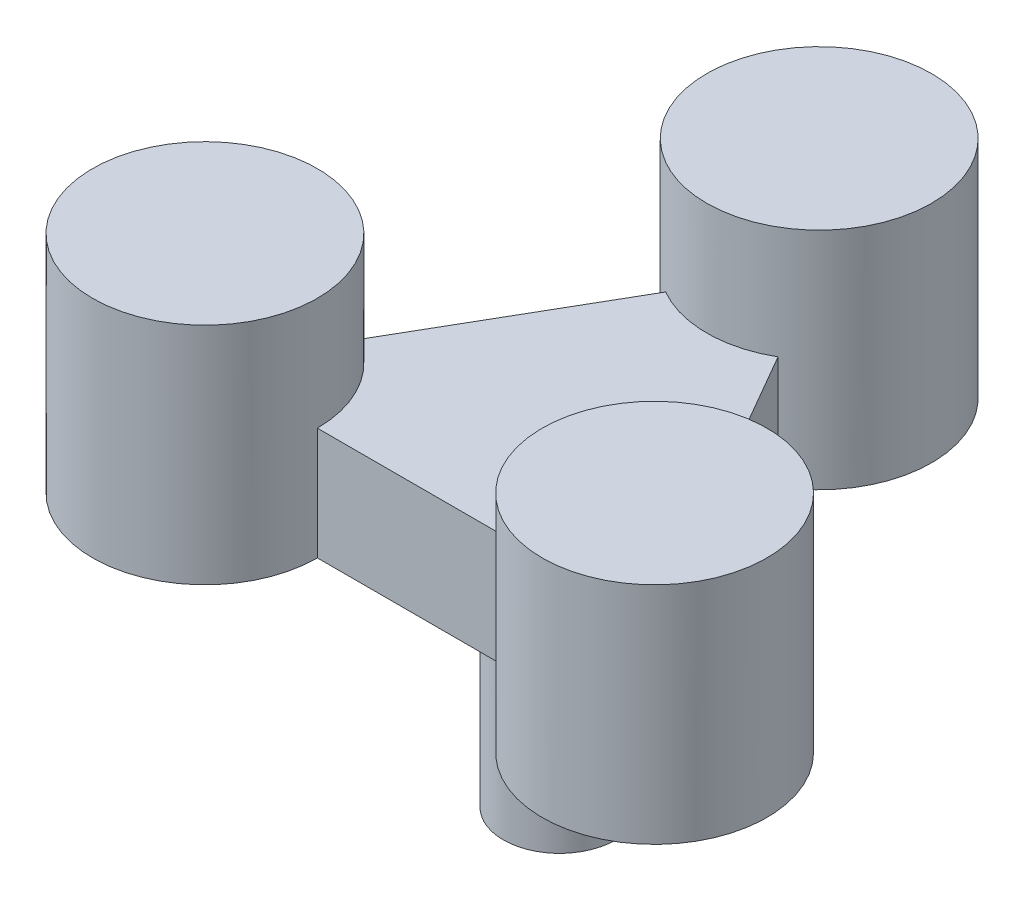
from build123d import *

# Parameters (mm, degrees)
BOSS_EXTRUDE1_DEPTH = 12.7
SKETCH2_R           = 12.7
BOSS_EXTRUDE2_DEPTH = 12.7
SKETCH3_R           = 6.35
BOSS_EXTRUDE3_DEPTH = 25.4


with BuildPart() as part:
    # Sketch1 → Boss-Extrude1 (new body)
    with BuildSketch(Plane(origin=(0, 0, 0), x_dir=(1, 0, 0), z_dir=(0, 1, 0))):
        with BuildLine():
            Line((-6.35, 18.330871047), (-19.05, -3.666174209))
            ThreePointArc((-19.05, -3.666174209), (-36.398522628, -21.014696837), (-12.7, -14.664696837))
            Line((-12.7, -14.664696837), (12.7, -14.664696837))
            ThreePointArc((12.7, -14.664696837), (36.398522628, -21.014696837), (19.05, -3.666174209))
            Line((19.05, -3.666174209), (6.35, 18.330871047))
            ThreePointArc((6.35, 18.330871047), (0, 42.029393675), (-6.35, 18.330871047))
        make_face()
    extrude(amount=BOSS_EXTRUDE1_DEPTH)

    # Sketch2 → Boss-Extrude2 (add)
    with BuildSketch(Plane(origin=(0, 12.7, 0), x_dir=(1, 0, 0), z_dir=(0, 1, 0))):
        with Locations(Location((-25.4, -14.664696837, 0), (0, 0, 60))):
            Circle(SKETCH2_R)
        with Locations(Location((25.4, -14.664696837, 0), (0, 0, 120))):
            Circle(SKETCH2_R)
        with Locations(Location((0, 29.329393675, 0), (0, 0, 240))):
            Circle(SKETCH2_R)
    extrude(amount=BOSS_EXTRUDE2_DEPTH)

    # Sketch3 → Boss-Extrude3 (add)
    with BuildSketch(Plane(origin=(0, 0, 0), x_dir=(-1, 0, 0), z_dir=(0, -1, 0))):
        with Locations(Location((0, 0, 0), (0, 0, 270))):
            Circle(SKETCH3_R)
    extrude(amount=BOSS_EXTRUDE3_DEPTH)


solid = part.part
